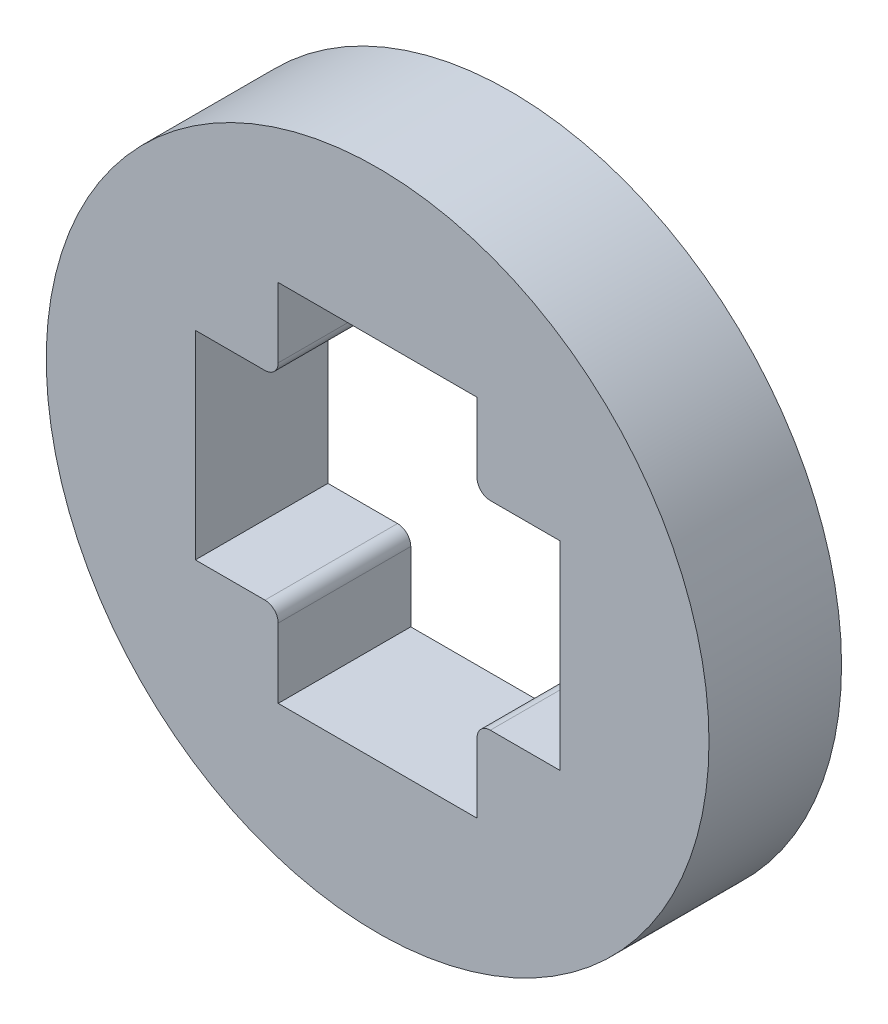
from build123d import *

# Parameters (mm, degrees)
SKETCH1_R           = 5
BOSS_EXTRUDE2_DEPTH = 2
FILLET2_R           = 0.2


with BuildPart() as part:
    # Sketch1 → Boss-Extrude2 (new body)
    with BuildSketch(Plane.XY):
        Circle(SKETCH1_R)
        Polygon((-2.75, -1.5), (-2.75, 1.5), (-1.5, 1.5), (-1.5, 2.75), (1.5, 2.75), (1.5, 1.5), (2.75, 1.5), (2.75, -1.5), (1.5, -1.5), (1.5, -2.75), (-1.5, -2.75), (-1.5, -1.5), align=None, mode=Mode.SUBTRACT)
    extrude(amount=BOSS_EXTRUDE2_DEPTH)

    # Fillet2
    fillet2_edges = [part.edges().sort_by_distance(p)[0] for p in [
        (-1.5, 1.5, 1),
        (-1.5, -1.5, 1),
        (1.5, -1.5, 1),
        (1.5, 1.5, 1),
    ]]
    fillet(fillet2_edges, radius=FILLET2_R)


solid = part.part
